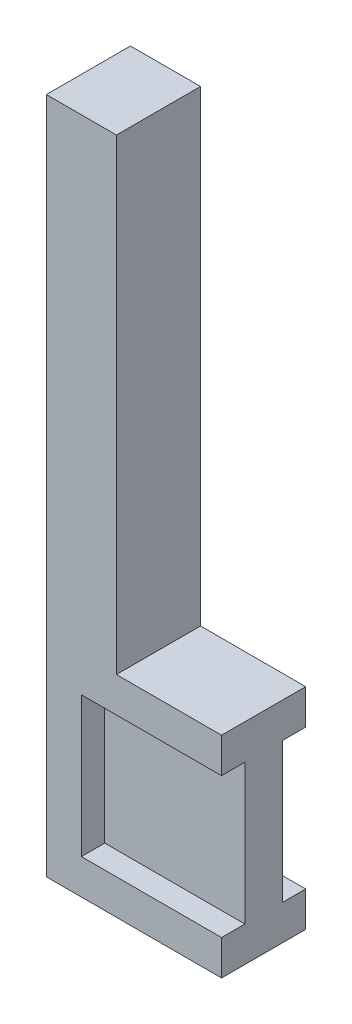
from build123d import *

# Parameters (mm, degrees)
ESQUISSE1_W             = 6
ESQUISSE1_H             = 6
BOSS_EXTRU_3_DEPTH      = 1.6
BOSS_EXTRU_4_DEPTH      = 1
BOSS_EXTRU_4_DEPTH_BACK = 2.6
ESQUISSE3_W             = 6
ESQUISSE3_H             = 1.5
ESQUISSE6_W             = 3
ESQUISSE6_H             = 3.6
BOSS_EXTRU_7_DEPTH      = 20


with BuildPart() as part:
    # Esquisse1 → Boss.-Extru.3 (new body)
    with BuildSketch(Plane.XY):
        with Locations((3, 3)):
            Rectangle(ESQUISSE1_W, ESQUISSE1_H)
    extrude(amount=BOSS_EXTRU_3_DEPTH)

    # Esquisse3 → Boss.-Extru.4 (add, two sides: drawn at the far end of the back side and taken through both)
    with BuildSketch(Plane.XY.offset(1.6).offset(-BOSS_EXTRU_4_DEPTH_BACK)):
        with Locations((3, 6.75)):
            Rectangle(ESQUISSE3_W, ESQUISSE3_H)
        Polygon((0, 7.5), (-1.5, 7.5), (-1.5, -1.5), (0, -1.5), (0, 0), (0, 6), align=None)
        with Locations((3, -0.75)):
            Rectangle(ESQUISSE3_W, ESQUISSE3_H)
    extrude(amount=BOSS_EXTRU_4_DEPTH + BOSS_EXTRU_4_DEPTH_BACK)

    # Esquisse6 → Boss.-Extru.7 (add)
    with BuildSketch(Plane(origin=(0, 7.5, 0), x_dir=(1, 0, 0), z_dir=(0, 1, 0))):
        with Locations((0, -0.8)):
            Rectangle(ESQUISSE6_W, ESQUISSE6_H)
    extrude(amount=BOSS_EXTRU_7_DEPTH)


solid = part.part
